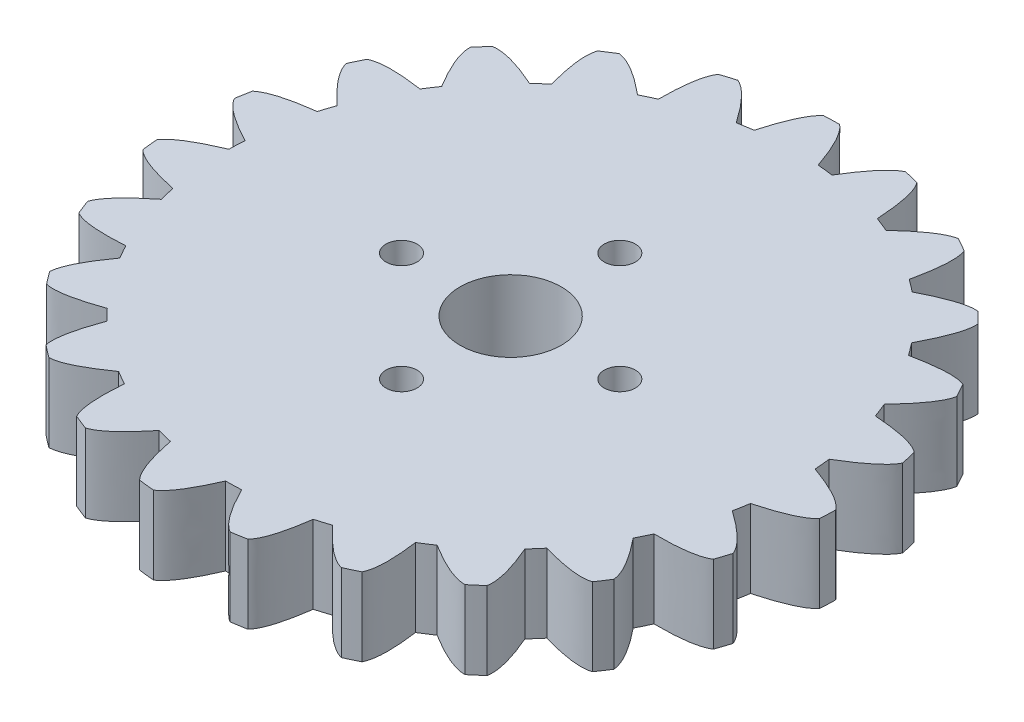
from build123d import *

# Parameters (mm, degrees)
SKETCH1_R           = 18.302818456
BOSS_EXTRUDE4_DEPTH = 5
CIRPATTERN6_COUNT   = 23
SKETCH2_R           = 3.25
CUT_EXTRUDE1_DEPTH  = 10
SKETCH5_R           = 1
CUT_EXTRUDE2_DEPTH  = 10
CIRPATTERN7_COUNT   = 4


with BuildPart() as part:
    # Sketch1 → Boss-Extrude4 (new body)
    with BuildSketch(Plane(origin=(0, 0, 0), x_dir=(1, 0, 0), z_dir=(0, 1, 0))):
        Circle(SKETCH1_R)
        with BuildLine():
            ThreePointArc((15.419368848, 14.540084225), (15.246769365, 14.720971737), (15.072047997, 14.89981054))
            ThreePointArc((15.072047997, 14.89981054), (14.89522906, 15.076575745), (14.716337163, 15.251242751))
            add(Edge.make_bspline(
                [(14.716337163, 15.251242751), (13.763926874, 15.361536707), (11.53530557, 14.210203687)],
                knots=[0.625249108, 0.625249108, 0.625249108, 1, 1, 1], degree=2))
            ThreePointArc((11.53530557, 14.210203687), (13.016205398, 12.867461305), (14.341839266, 11.371227282))
            add(Edge.make_bspline(
                [(14.341839266, 11.371227282), (15.518709564, 13.586469241), (15.419368848, 14.540084225)],
                knots=[0, 0, 0, 0.374750892, 0.374750892, 0.374750892], degree=2))
        make_face()
    boss_extrude4 = extrude(amount=BOSS_EXTRUDE4_DEPTH)

    # CirPattern6: Boss-Extrude4 ×23 about axis
    cirpattern6_axis = Axis((0, 5, 0), (0, 1, 0))
    for i in range(1, CIRPATTERN6_COUNT):
        add(boss_extrude4.rotate(cirpattern6_axis, i * 360 / CIRPATTERN6_COUNT))

    # Sketch2 → Cut-Extrude1 (cut)
    with BuildSketch(Plane(origin=(0, 5, 0), x_dir=(1, 0, 0), z_dir=(0, 1, 0))):
        with Locations(Location((0, 0, 0), (0, 0, 270))):
            Circle(SKETCH2_R)
    extrude(amount=-CUT_EXTRUDE1_DEPTH, mode=Mode.SUBTRACT)

    # Sketch5 → Cut-Extrude2 (cut)
    with BuildSketch(Plane(origin=(0, 5, 0), x_dir=(1, 0, 0), z_dir=(0, 1, 0))):
        with Locations(Location((7, 0, 0), (0, 0, 270))):
            Circle(SKETCH5_R)
    cut_extrude2 = extrude(amount=-CUT_EXTRUDE2_DEPTH, mode=Mode.SUBTRACT)

    # CirPattern7: Cut-Extrude2 ×4 about axis
    cirpattern7_axis = Axis((0, 0, 0), (0, 1, 0))
    for i in range(1, CIRPATTERN7_COUNT):
        add(cut_extrude2.rotate(cirpattern7_axis, i * 360 / CIRPATTERN7_COUNT), mode=Mode.SUBTRACT)


solid = part.part
